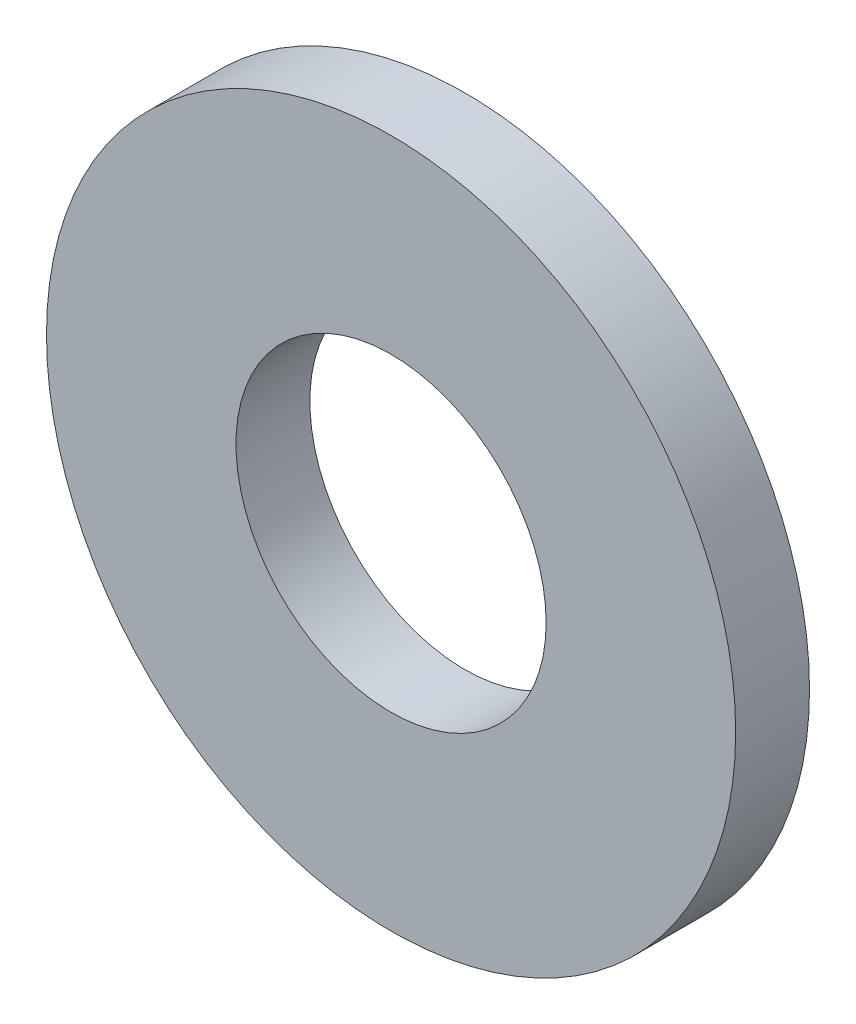
from build123d import *

# Parameters (mm, degrees)
SKETCH_1_R      = 7
SKETCH_1_R_2    = 3.15
EXTRUDE_1_DEPTH = 1.5


with BuildPart() as part:
    # Эскиз1 → Бобышка-Вытянуть1 (new body)
    with BuildSketch(Plane.XY):
        Circle(SKETCH_1_R)
        Circle(SKETCH_1_R_2, mode=Mode.SUBTRACT)
    extrude(amount=EXTRUDE_1_DEPTH)


solid = part.part
